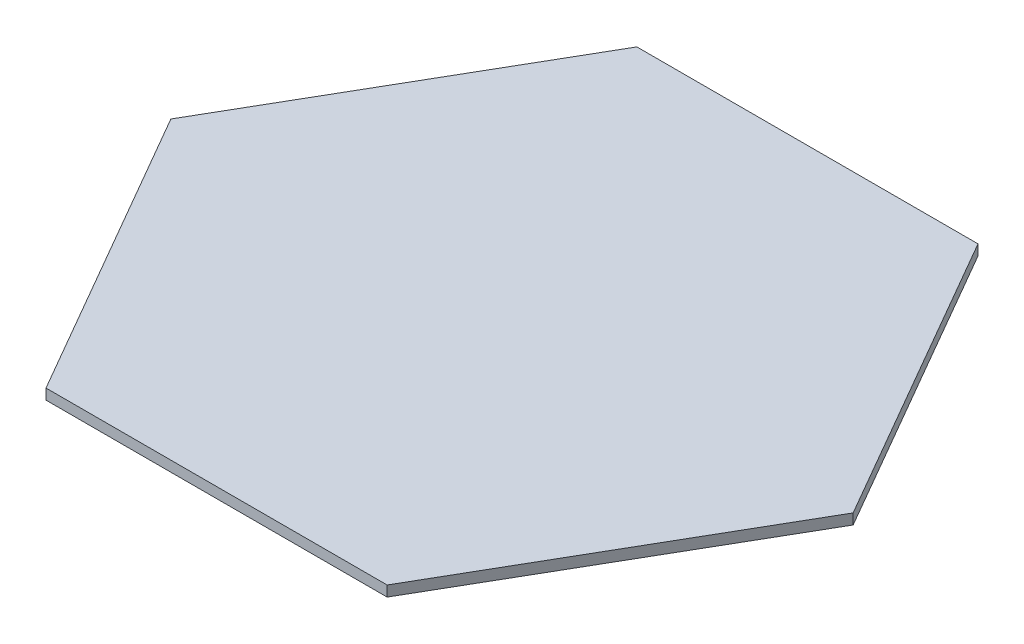
from build123d import *

# Parameters (mm, degrees)
EXTRUDE_1_DEPTH = 2


with BuildPart() as part:
    # 草图1 → 凸台-拉伸1 (new body)
    with BuildSketch(Plane(origin=(0, -1, 0), x_dir=(1, 0, 0), z_dir=(0, 1, 0))):
        Polygon((65, 0), (32.5, 56.291651246), (-32.5, 56.291651246), (-65, 0), (-32.5, -56.291651246), (32.5, -56.291651246), align=None)
    extrude(amount=-EXTRUDE_1_DEPTH)


solid = part.part
